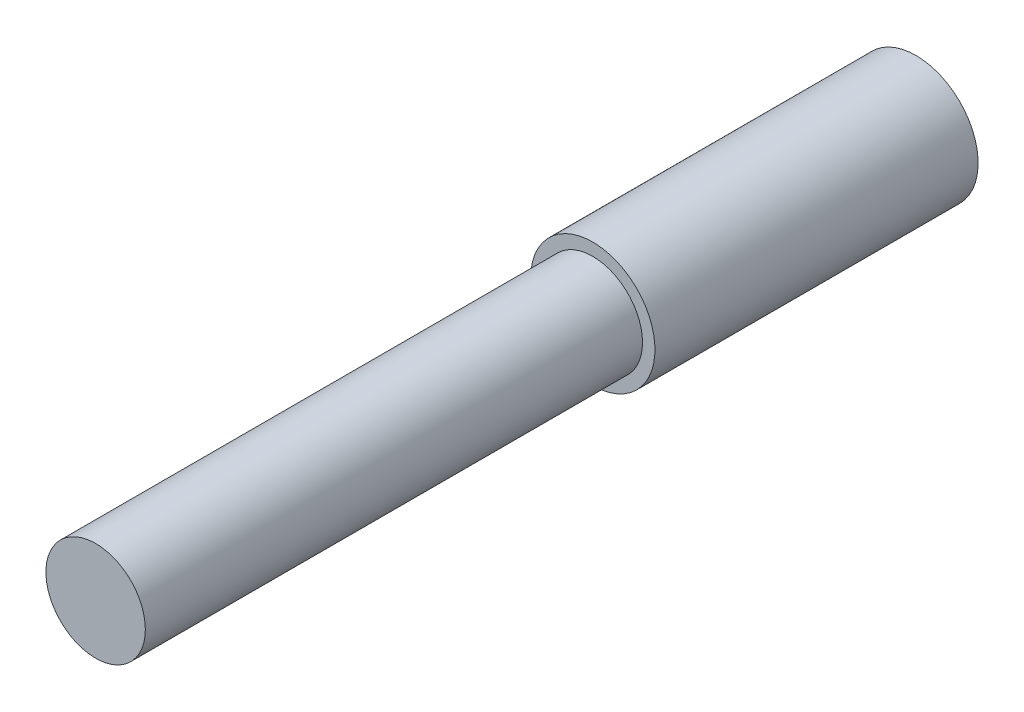
from build123d import *

# Parameters (mm, degrees)
SKETCH1_R           = 2.5
BOSS_EXTRUDE2_DEPTH = 13
SKETCH2_R           = 2
BOSS_EXTRUDE3_DEPTH = 20


with BuildPart() as part:
    # Sketch1 → Boss-Extrude2 (new body)
    with BuildSketch(Plane.XY):
        with Locations(Location((0, 0, 0), (0, 0, 180))):
            Circle(SKETCH1_R)
    extrude(amount=BOSS_EXTRUDE2_DEPTH)

    # Sketch2 → Boss-Extrude3 (add)
    with BuildSketch(Plane.XY.offset(13)):
        Circle(SKETCH2_R)
    extrude(amount=BOSS_EXTRUDE3_DEPTH)


solid = part.part
